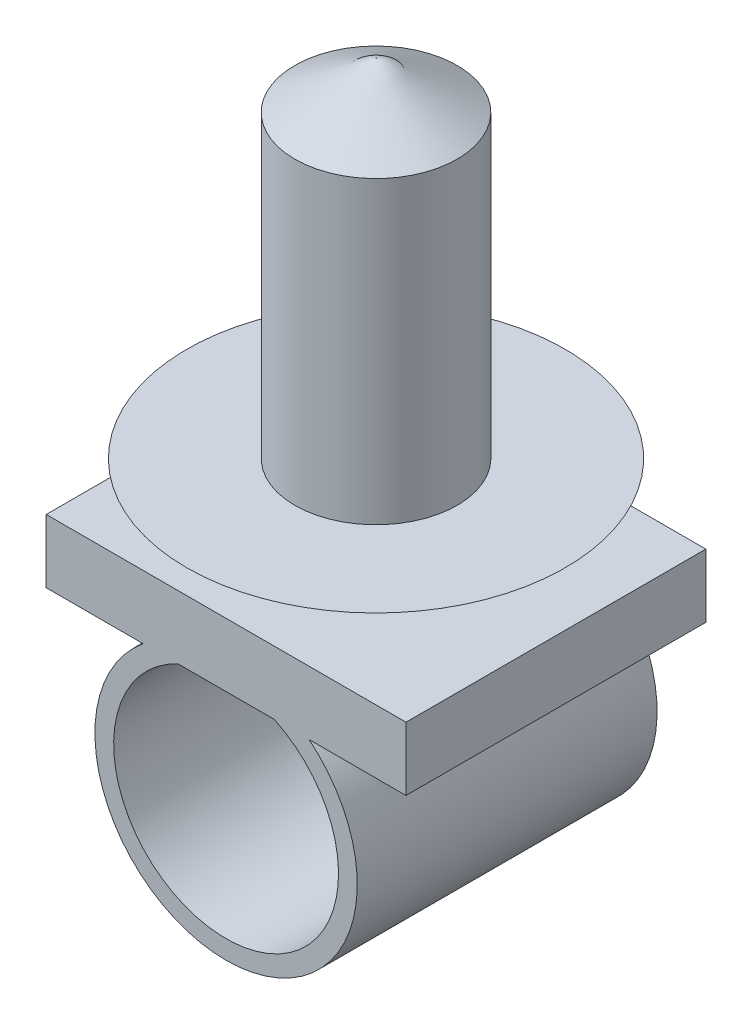
from build123d import *

# Parameters (mm, degrees)
SKETCH1_R           = 5.25
SKETCH1_R_2         = 4.5
BOSS_EXTRUDE1_DEPTH = 12
BOSS_EXTRUDE2_DEPTH = 2.54
SKETCH3_R           = 3.175
BOSS_EXTRUDE3_DEPTH = 2.54
BOSS_EXTRUDE3_DRAFT = -60
SKETCH4_R           = 3.25
BOSS_EXTRUDE4_DEPTH = 12


with BuildPart() as part:
    # Sketch1 → Boss-Extrude1 (new body)
    with BuildSketch(Plane.XY):
        Circle(SKETCH1_R)
        Circle(SKETCH1_R_2, mode=Mode.SUBTRACT)
    extrude(amount=BOSS_EXTRUDE1_DEPTH)

    # Sketch2 → Boss-Extrude2 (add)
    with BuildSketch(Plane(origin=(0, 4.064, 0), x_dir=(1, 0, 0), z_dir=(0, 1, 0))):
        Polygon((0, 0), (7.2, 0), (7.2, -12), (-7.2, -12), (-7.2, 0), align=None)
    extrude(amount=BOSS_EXTRUDE2_DEPTH)


with BuildPart() as boss_extrude3_tool:
    # Sketch3 → Boss-Extrude3 (with draft: the straight prism first)
    with BuildSketch(Plane(origin=(0, 6.604, 0), x_dir=(1, 0, 0), z_dir=(0, 1, 0))):
        with Locations((0, -6)):
            Circle(SKETCH3_R)
    extrude(amount=BOSS_EXTRUDE3_DEPTH)
    # Boss-Extrude3: the draft: its side faces are tilted about the plane it starts from
    boss_extrude3_sides = [boss_extrude3_tool.faces().sort_by_distance(p)[0] for p in [
        (-3.175, 7.874, 6),
    ]]
    draft(boss_extrude3_sides, Plane(origin=(0, 6.604, 0), x_dir=(1, 0, 0), z_dir=(0, 1, 0)), BOSS_EXTRUDE3_DRAFT)


with BuildPart() as part_1:
    add(part.part)

    # Boss-Extrude3: add boss_extrude3_tool
    add(boss_extrude3_tool.part)

    # Sketch4 → Boss-Extrude4 (add)
    with BuildSketch(Plane(origin=(0, 9.144, 0), x_dir=(1, 0, 0), z_dir=(0, 1, 0))):
        with Locations(Location((0, -6, 0), (0, 0, 270))):
            Circle(SKETCH4_R)
    extrude(amount=BOSS_EXTRUDE4_DEPTH)

    # Boss-Extrude5 cone 1 section (through the dimple's axis) → Boss-Extrude5 (revolve)
    with BuildSketch(Plane(origin=(0, 21.144, 6), x_dir=(0, 0, -1), z_dir=(1, 0, 0))):
        Polygon((0, 0), (3.25, 0), (0, 1.876388375), align=None)
    revolve(axis=Axis((0, 21.144, 6), (0, 1, 0)))


solid = part_1.part
